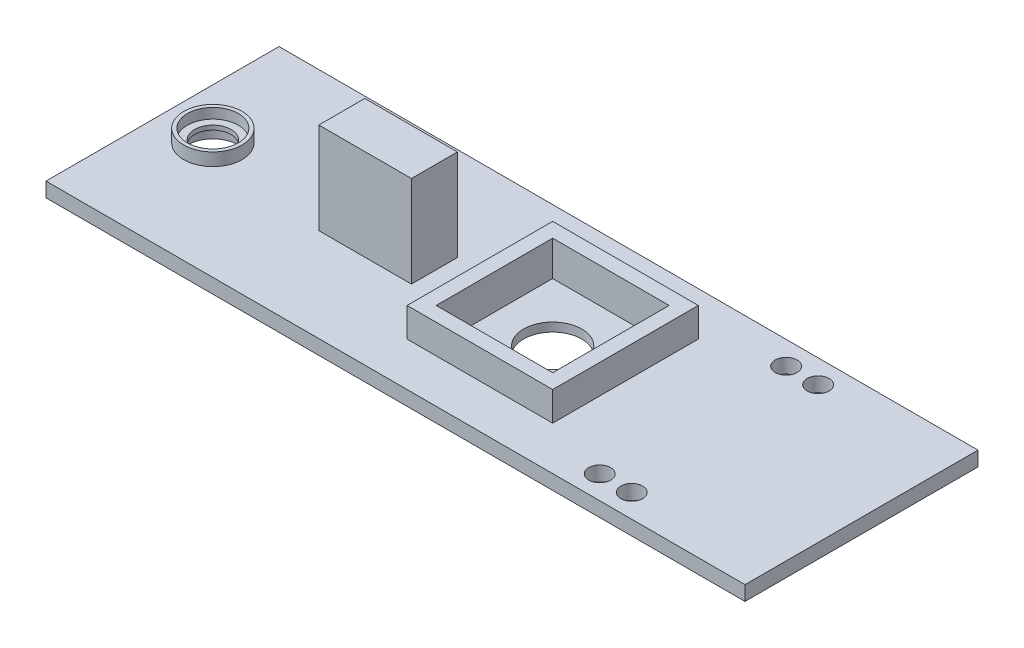
from build123d import *

# Parameters (mm, degrees)
SKETCH1_W           = 304.8
SKETCH1_H           = 101.6
BOSS_EXTRUDE1_DEPTH = 6.35
SKETCH2_R           = 12.7
BOSS_EXTRUDE3_DEPTH = 5.55625
SKETCH9_R           = 11.1125
CUT_EXTRUDE4_DEPTH  = 4.445
CUT_EXTRUDE5_START  = -5.55625
SKETCH10_R          = 11.1125
CUT_EXTRUDE5_DEPTH  = 5.55625
SKETCH11_R          = 7.9375
CUT_EXTRUDE6_DEPTH  = 310.094403462
SKETCH12_R          = 12.7
CUT_EXTRUDE7_DEPTH  = 310.0695755
SKETCH22_W          = 63.5
SKETCH22_H          = 63.5
BOSS_EXTRUDE7_DEPTH = 12.7
SKETCH25_W          = 50.8
SKETCH25_H          = 50.8
CUT_EXTRUDE11_DEPTH = 15.24
SKETCH18_W          = 40.386
SKETCH18_H          = 20.066
BOSS_EXTRUDE5_DEPTH = 39.878
SKETCH32_R          = 4.7625
CUT_EXTRUDE12_DEPTH = 6.35


with BuildPart() as part:
    # Sketch1 → Boss-Extrude1 (new body)
    with BuildSketch(Plane(origin=(0, 0, 0), x_dir=(1, 0, 0), z_dir=(0, 1, 0))):
        with Locations((-152.4, 0)):
            Rectangle(SKETCH1_W, SKETCH1_H)
    extrude(amount=BOSS_EXTRUDE1_DEPTH)

    # Sketch2 → Boss-Extrude3 (add)
    with BuildSketch(Plane(origin=(0, 6.35, 0), x_dir=(1, 0, 0), z_dir=(0, 1, 0))):
        with Locations(Location((-282.839226834, 0, 0), (0, 0, 90))):
            Circle(SKETCH2_R)
    extrude(amount=BOSS_EXTRUDE3_DEPTH)

    # Sketch9 → Cut-Extrude4 (cut)
    with BuildSketch(Plane(origin=(0, 11.90625, 0), x_dir=(1, 0, 0), z_dir=(0, 1, 0))):
        with Locations(Location((-282.839226834, 0, 0), (0, 0, 270))):
            Circle(SKETCH9_R)
    extrude(amount=-CUT_EXTRUDE4_DEPTH, mode=Mode.SUBTRACT)

    # Sketch10 → Cut-Extrude5 (cut)
    with BuildSketch(Plane(origin=(0, 0, 0), x_dir=(-1, 0, 0), z_dir=(0, -1, 0)).offset(CUT_EXTRUDE5_START)):
        with Locations(Location((282.839226834, 0, 0), (0, 0, 270))):
            Circle(SKETCH10_R)
    extrude(amount=CUT_EXTRUDE5_DEPTH, mode=Mode.SUBTRACT)

    # Sketch11 → Cut-Extrude6 (cut, through all)
    with BuildSketch(Plane(origin=(0, 7.46125, 0), x_dir=(1, 0, 0), z_dir=(0, 1, 0))):
        with Locations(Location((-282.839226834, 0, 0), (0, 0, 270))):
            Circle(SKETCH11_R)
    extrude(amount=-CUT_EXTRUDE6_DEPTH, mode=Mode.SUBTRACT)

    # Sketch12 → Cut-Extrude7 (cut, through all)
    with BuildSketch(Plane(origin=(0, 6.35, 0), x_dir=(1, 0, 0), z_dir=(0, 1, 0))):
        with Locations(Location((-134.666203771, 0, 0), (0, 0, 270))):
            Circle(SKETCH12_R)
    extrude(amount=-CUT_EXTRUDE7_DEPTH, mode=Mode.SUBTRACT)

    # Sketch22 → Boss-Extrude7 (add)
    with BuildSketch(Plane(origin=(0, 6.35, 0), x_dir=(1, 0, 0), z_dir=(0, 1, 0))):
        with Locations((-134.666203771, 0)):
            Rectangle(SKETCH22_W, SKETCH22_H)
    extrude(amount=BOSS_EXTRUDE7_DEPTH)

    # Sketch25 → Cut-Extrude11 (cut)
    with BuildSketch(Plane(origin=(0, 19.05, 0), x_dir=(1, 0, 0), z_dir=(0, 1, 0))):
        with Locations((-134.666203771, 0)):
            Rectangle(SKETCH25_W, SKETCH25_H)
    extrude(amount=-CUT_EXTRUDE11_DEPTH, mode=Mode.SUBTRACT)

    # Sketch18 → Boss-Extrude5 (add)
    with BuildSketch(Plane(origin=(0, 6.35, 0), x_dir=(1, 0, 0), z_dir=(0, 1, 0))):
        with Locations((-206.419013169, 0)):
            Rectangle(SKETCH18_W, SKETCH18_H)
    extrude(amount=BOSS_EXTRUDE5_DEPTH)

    # Sketch32 → Cut-Extrude12 (cut)
    with BuildSketch(Plane(origin=(0, 6.35, 0), x_dir=(1, 0, 0), z_dir=(0, 1, 0))):
        with Locations(Location((-59.544913048, -40.64, 0), (0, 0, 270))):
            Circle(SKETCH32_R)
        with Locations(Location((-73.514913048, -40.64, 0), (0, 0, 270))):
            Circle(SKETCH32_R)
        with Locations(Location((-59.544913048, 40.64, 0), (0, 0, 270))):
            Circle(SKETCH32_R)
        with Locations(Location((-73.514913048, 40.64, 0), (0, 0, 270))):
            Circle(SKETCH32_R)
    extrude(amount=-CUT_EXTRUDE12_DEPTH, mode=Mode.SUBTRACT)


solid = part.part
